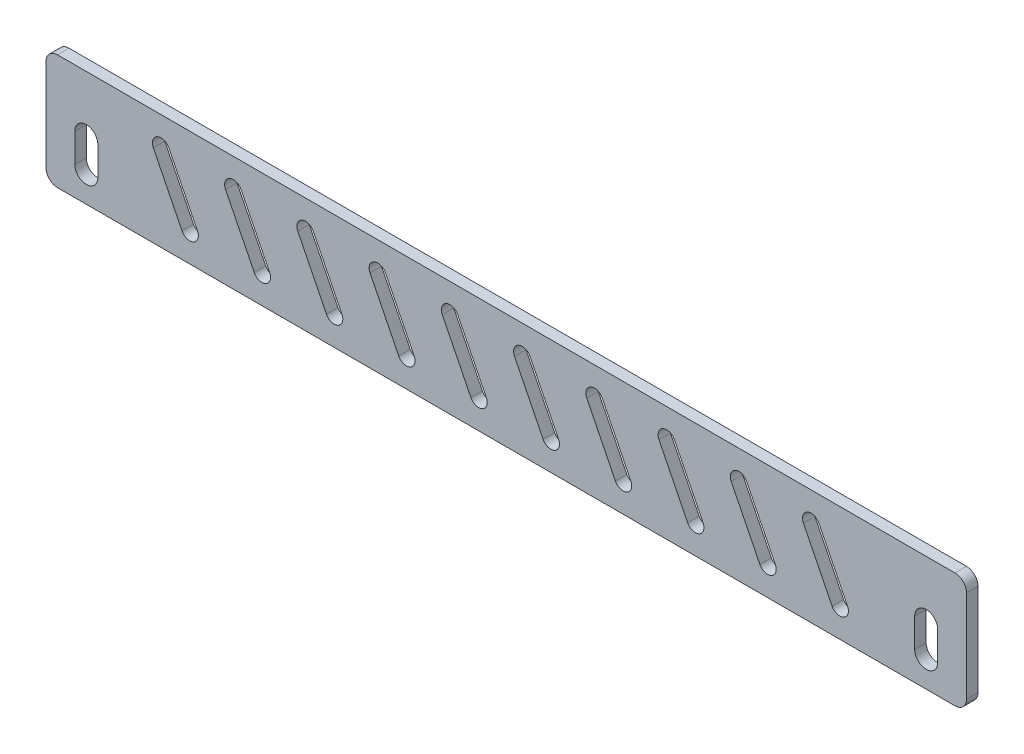
from build123d import *

# Parameters (mm, degrees)
SKETCH1_W           = 160
SKETCH1_H           = 20
BOSS_EXTRUDE1_DEPTH = 2
FILLET1_R           = 2
CUT_EXTRUDE1_DEPTH  = 81.647380615
CUT_EXTRUDE2_DEPTH  = 10


with BuildPart() as part:
    # Sketch1 → Boss-Extrude1 (new body)
    with BuildSketch(Plane.XY):
        Rectangle(SKETCH1_W, SKETCH1_H)
    extrude(amount=BOSS_EXTRUDE1_DEPTH)

    # Fillet1
    fillet1_edges = [part.edges().sort_by_distance(p)[0] for p in [
        (80, -10, 1),
        (-80, -10, 1),
        (-80, 10, 1),
        (80, 10, 1),
    ]]
    fillet(fillet1_edges, radius=FILLET1_R)

    # Sketch2 → Cut-Extrude1 (cut, through all)
    with BuildSketch(Plane.XY.offset(2)):
        with BuildLine():
            Line((-70.99, 0), (-70.99, -5))
            ThreePointArc((-70.99, -5), (-72.995, -7.005), (-75, -5))
            Line((-75, -5), (-75, 0))
            ThreePointArc((-75, 0), (-72.995, 2.005), (-70.99, 0))
        make_face()
        with BuildLine():
            Line((70.99, 0), (70.99, -5))
            ThreePointArc((70.99, -5), (72.995, -7.005), (75, -5))
            Line((75, -5), (75, 0))
            ThreePointArc((75, 0), (72.995, 2.005), (70.99, 0))
        make_face()
    extrude(amount=-CUT_EXTRUDE1_DEPTH, mode=Mode.SUBTRACT)

    # Sketch3 → Cut-Extrude2 (cut)
    with BuildSketch(Plane.XY.offset(2)):
        with BuildLine():
            Line((-58.657225294, 5.668547746), (-53.678372606, -4.331452254))
            ThreePointArc((-53.678372606, -4.331452254), (-54.352599567, -6.342774706), (-56.363922019, -5.668547746))
            Line((-56.363922019, -5.668547746), (-61.342774706, 4.331452254))
            ThreePointArc((-61.342774706, 4.331452254), (-60.668547746, 6.342774706), (-58.657225294, 5.668547746))
        make_face()
        with BuildLine():
            Line((-46.101669738, 5.668547746), (-41.12281705, -4.331452254))
            ThreePointArc((-41.12281705, -4.331452254), (-41.797044011, -6.342774706), (-43.808366463, -5.668547746))
            Line((-43.808366463, -5.668547746), (-48.787219151, 4.331452254))
            ThreePointArc((-48.787219151, 4.331452254), (-48.11299219, 6.342774706), (-46.101669738, 5.668547746))
        make_face()
        with BuildLine():
            Line((-33.546114183, 5.668547746), (-28.567261495, -4.331452254))
            ThreePointArc((-28.567261495, -4.331452254), (-29.241488456, -6.342774706), (-31.252810907, -5.668547746))
            Line((-31.252810907, -5.668547746), (-36.231663595, 4.331452254))
            ThreePointArc((-36.231663595, 4.331452254), (-35.557436634, 6.342774706), (-33.546114183, 5.668547746))
        make_face()
        with BuildLine():
            Line((-20.990558627, 5.668547746), (-16.011705939, -4.331452254))
            ThreePointArc((-16.011705939, -4.331452254), (-16.6859329, -6.342774706), (-18.697255352, -5.668547746))
            Line((-18.697255352, -5.668547746), (-23.67610804, 4.331452254))
            ThreePointArc((-23.67610804, 4.331452254), (-23.001881079, 6.342774706), (-20.990558627, 5.668547746))
        make_face()
        with BuildLine():
            Line((-8.435003071, 5.668547746), (-3.456150384, -4.331452254))
            ThreePointArc((-3.456150384, -4.331452254), (-4.130377344, -6.342774706), (-6.141699796, -5.668547746))
            Line((-6.141699796, -5.668547746), (-11.120552484, 4.331452254))
            ThreePointArc((-11.120552484, 4.331452254), (-10.446325523, 6.342774706), (-8.435003071, 5.668547746))
        make_face()
        with BuildLine():
            Line((4.120552484, 5.668547746), (9.099405172, -4.331452254))
            ThreePointArc((9.099405172, -4.331452254), (8.425178211, -6.342774706), (6.413855759, -5.668547746))
            Line((6.413855759, -5.668547746), (1.435003071, 4.331452254))
            ThreePointArc((1.435003071, 4.331452254), (2.109230032, 6.342774706), (4.120552484, 5.668547746))
        make_face()
        with BuildLine():
            Line((16.67610804, 5.668547746), (21.654960727, -4.331452254))
            ThreePointArc((21.654960727, -4.331452254), (20.980733767, -6.342774706), (18.969411315, -5.668547746))
            Line((18.969411315, -5.668547746), (13.990558627, 4.331452254))
            ThreePointArc((13.990558627, 4.331452254), (14.664785588, 6.342774706), (16.67610804, 5.668547746))
        make_face()
        with BuildLine():
            Line((29.231663595, 5.668547746), (34.210516283, -4.331452254))
            ThreePointArc((34.210516283, -4.331452254), (33.536289322, -6.342774706), (31.52496687, -5.668547746))
            Line((31.52496687, -5.668547746), (26.546114183, 4.331452254))
            ThreePointArc((26.546114183, 4.331452254), (27.220341143, 6.342774706), (29.231663595, 5.668547746))
        make_face()
        with BuildLine():
            Line((41.787219151, 5.668547746), (46.766071839, -4.331452254))
            ThreePointArc((46.766071839, -4.331452254), (46.091844878, -6.342774706), (44.080522426, -5.668547746))
            Line((44.080522426, -5.668547746), (39.101669738, 4.331452254))
            ThreePointArc((39.101669738, 4.331452254), (39.775896699, 6.342774706), (41.787219151, 5.668547746))
        make_face()
        with BuildLine():
            Line((54.342774706, 5.668547746), (59.321627394, -4.331452254))
            ThreePointArc((59.321627394, -4.331452254), (58.647400433, -6.342774706), (56.636077981, -5.668547746))
            Line((56.636077981, -5.668547746), (51.657225294, 4.331452254))
            ThreePointArc((51.657225294, 4.331452254), (52.331452254, 6.342774706), (54.342774706, 5.668547746))
        make_face()
    extrude(amount=-CUT_EXTRUDE2_DEPTH, mode=Mode.SUBTRACT)


solid = part.part
